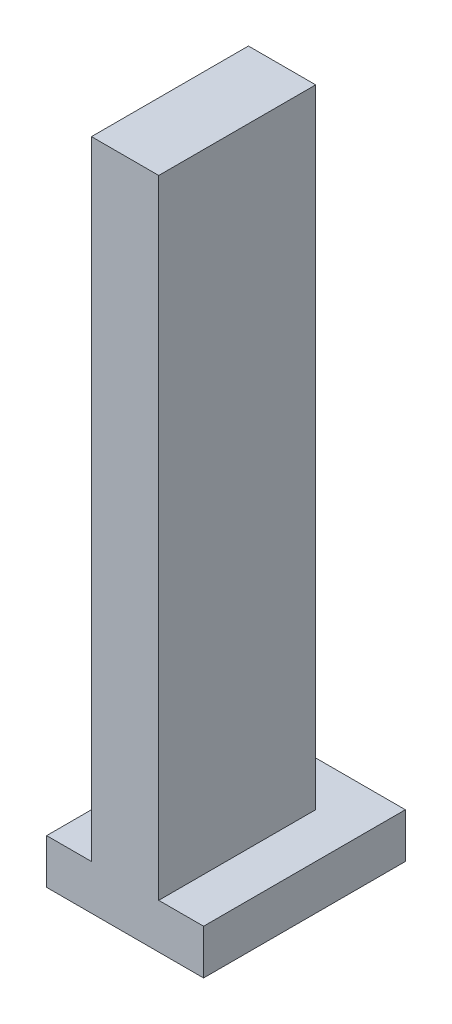
from build123d import *

# Parameters (mm, degrees)
SKETCH1_W           = 1.5
SKETCH1_H           = 3.5
BOSS_EXTRUDE1_DEPTH = 15
SKETCH2_W           = 3.5
SKETCH2_H           = 5.5
BOSS_EXTRUDE2_DEPTH = 1
SKETCH3_W           = 3.5
SKETCH3_H           = 1
CUT_EXTRUDE1_DEPTH  = 1


with BuildPart() as part:
    # Sketch1 → Boss-Extrude1 (new body)
    with BuildSketch(Plane(origin=(0, 0, 0), x_dir=(1, 0, 0), z_dir=(0, 1, 0))):
        Rectangle(SKETCH1_W, SKETCH1_H)
    extrude(amount=BOSS_EXTRUDE1_DEPTH)

    # Sketch2 → Boss-Extrude2 (add)
    with BuildSketch(Plane(origin=(0, 0, 0), x_dir=(1, 0, 0), z_dir=(0, 1, 0))):
        Rectangle(SKETCH2_W, SKETCH2_H)
    extrude(amount=BOSS_EXTRUDE2_DEPTH)

    # Sketch3 → Cut-Extrude1 (cut)
    with BuildSketch(Plane(origin=(0, 1, 0), x_dir=(1, 0, 0), z_dir=(0, 1, 0))):
        with Locations((0, -2.25)):
            Rectangle(SKETCH3_W, SKETCH3_H)
    extrude(amount=-CUT_EXTRUDE1_DEPTH, mode=Mode.SUBTRACT)


solid = part.part
